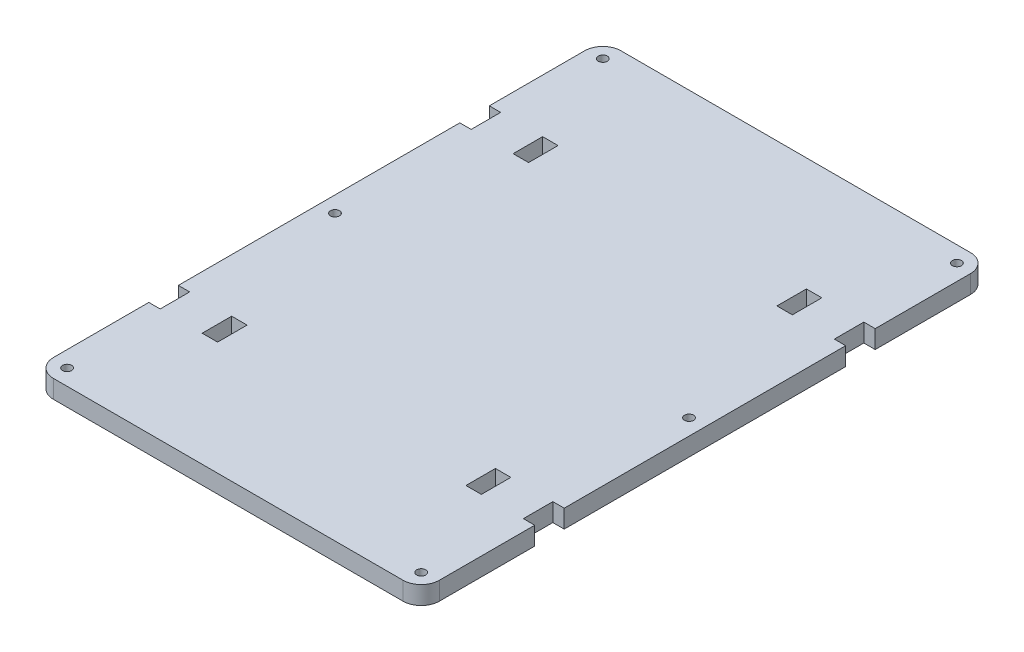
from build123d import *

# Parameters (mm, degrees)
SKETCH1_W           = 170
SKETCH1_H           = 250
BOSS_EXTRUDE1_DEPTH = 8
SKETCH2_W           = 5
SKETCH2_H           = 13
CUT_EXTRUDE1_DEPTH  = 8
SKETCH3_R           = 2
SKETCH3_W           = 6.8
SKETCH3_H           = 13
CUT_EXTRUDE2_DEPTH  = 8
FILLET1_R           = 8


with BuildPart() as part:
    # Sketch1 → Boss-Extrude1 (new body)
    with BuildSketch(Plane(origin=(0, 0, 0), x_dir=(1, 0, 0), z_dir=(0, 1, 0))):
        Rectangle(SKETCH1_W, SKETCH1_H)
    extrude(amount=BOSS_EXTRUDE1_DEPTH)

    # Sketch2 → Cut-Extrude1 (cut)
    with BuildSketch(Plane(origin=(0, 8, 0), x_dir=(1, 0, 0), z_dir=(0, 1, 0))):
        with Locations((82.5, 68.5)):
            Rectangle(SKETCH2_W, SKETCH2_H)
        with Locations((-82.5, 68.5)):
            Rectangle(SKETCH2_W, SKETCH2_H)
        with Locations((82.5, -68.5)):
            Rectangle(SKETCH2_W, SKETCH2_H)
        with Locations((-82.5, -68.5)):
            Rectangle(SKETCH2_W, SKETCH2_H)
    extrude(amount=-CUT_EXTRUDE1_DEPTH, mode=Mode.SUBTRACT)

    # Sketch3 → Cut-Extrude2 (cut)
    with BuildSketch(Plane(origin=(0, 8, 0), x_dir=(1, 0, 0), z_dir=(0, 1, 0))):
        with Locations(Location((-78, 118, 0), (0, 0, 270))):
            Circle(SKETCH3_R)
        with Locations(Location((78, 118, 0), (0, 0, 90))):
            Circle(SKETCH3_R)
        with Locations(Location((78, -118, 0), (0, 0, 270))):
            Circle(SKETCH3_R)
        with Locations(Location((-78, -118, 0), (0, 0, 90))):
            Circle(SKETCH3_R)
        with Locations(Location((-78, 0, 0), (0, 0, 270))):
            Circle(SKETCH3_R)
        with Locations(Location((78, 0, 0), (0, 0, 90))):
            Circle(SKETCH3_R)
        with Locations((-58.1, 68.5)):
            Rectangle(SKETCH3_W, SKETCH3_H)
        with Locations((58.1, 68.5)):
            Rectangle(SKETCH3_W, SKETCH3_H)
        with Locations((58.1, -68.5)):
            Rectangle(SKETCH3_W, SKETCH3_H)
        with Locations((-58.1, -68.5)):
            Rectangle(SKETCH3_W, SKETCH3_H)
    extrude(amount=-CUT_EXTRUDE2_DEPTH, mode=Mode.SUBTRACT)

    # Fillet1
    fillet1_edges = [part.edges().sort_by_distance(p)[0] for p in [
        (85, 4, 125),
        (-85, 4, 125),
        (-85, 4, -125),
        (85, 4, -125),
    ]]
    fillet(fillet1_edges, radius=FILLET1_R)


solid = part.part
